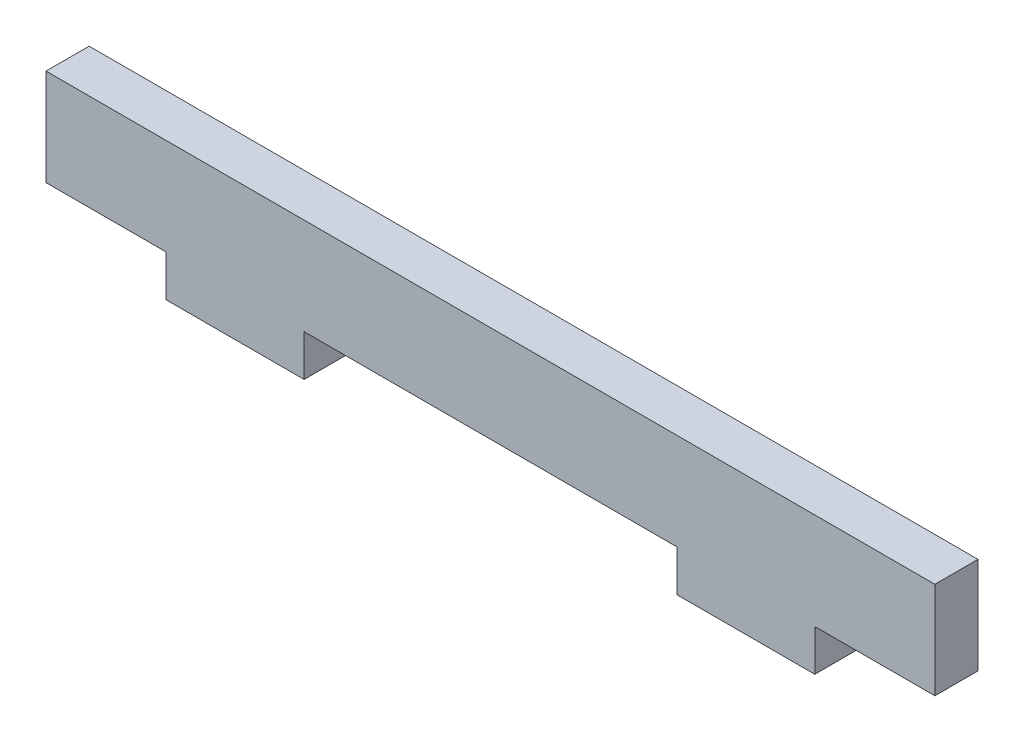
from build123d import *

# Parameters (mm, degrees)
BOSS_EXTRUDE1_DEPTH = 3.125


with BuildPart() as part:
    # Sketch1 → Boss-Extrude1 (new body)
    with BuildSketch(Plane.XY):
        Polygon((-26.808510638, 9.712765957), (-26.808510638, 2.712765957), (-18.108510638, 2.712765957), (-18.108510638, -0.287234043), (-8.108510638, -0.287234043), (-8.108510638, 2.712765957), (18.891489362, 2.712765957), (18.891489362, -0.287234043), (28.891489362, -0.287234043), (28.891489362, 2.712765957), (37.591489362, 2.712765957), (37.591489362, 9.712765957), align=None)
    extrude(amount=BOSS_EXTRUDE1_DEPTH)


solid = part.part
